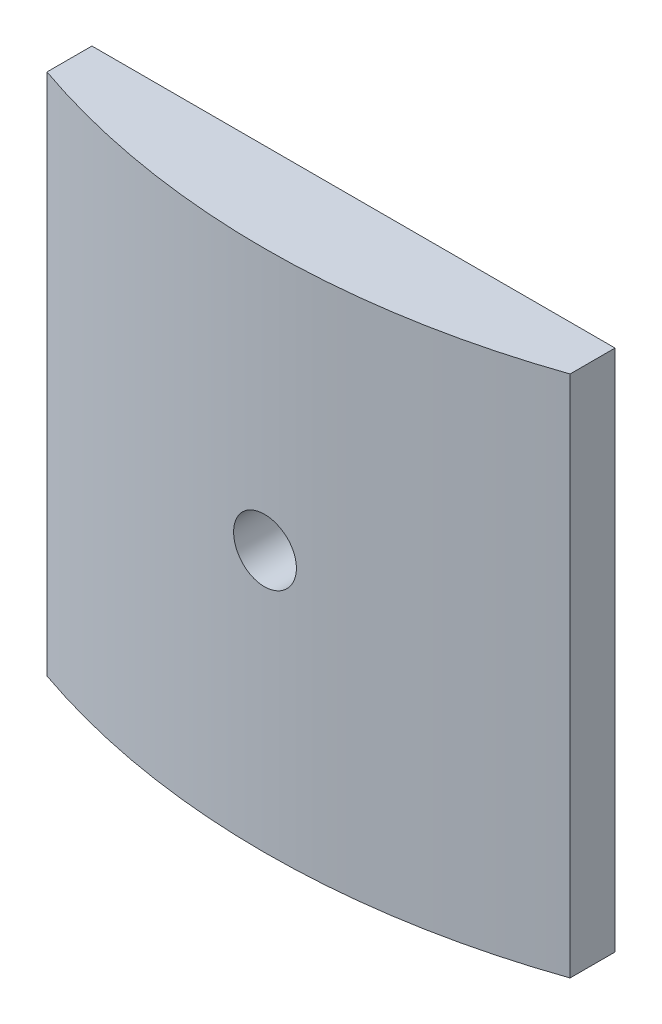
from build123d import *

# Parameters (mm, degrees)
BOSS_EXTRUDE1_DEPTH = 25
SKETCH3_R           = 1.5
CUT_EXTRUDE1_DEPTH  = 20


with BuildPart() as part:
    # Sketch2 → Boss-Extrude1 (new body)
    with BuildSketch(Plane(origin=(0, 0, 0), x_dir=(1, 0, 0), z_dir=(0, 1, 0))):
        with BuildLine():
            Line((0, -33.8431677), (-12.5, -33.8431677))
            Line((-12.5, -33.8431677), (-12.5, -35.991110013))
            ThreePointArc((-12.5, -35.991110013), (0, -38.1), (12.5, -35.991110013))
            Line((12.5, -35.991110013), (12.5, -33.8431677))
            Line((12.5, -33.8431677), (0, -33.8431677))
        make_face()
    extrude(amount=BOSS_EXTRUDE1_DEPTH)

    # Sketch3 → Cut-Extrude1 (cut)
    with BuildSketch(Plane(origin=(0, 0, 33.8431677), x_dir=(-1, 0, 0), z_dir=(0, 0, -1))):
        with Locations((0, 12.5)):
            Circle(SKETCH3_R)
    extrude(amount=-CUT_EXTRUDE1_DEPTH, mode=Mode.SUBTRACT)


solid = part.part
